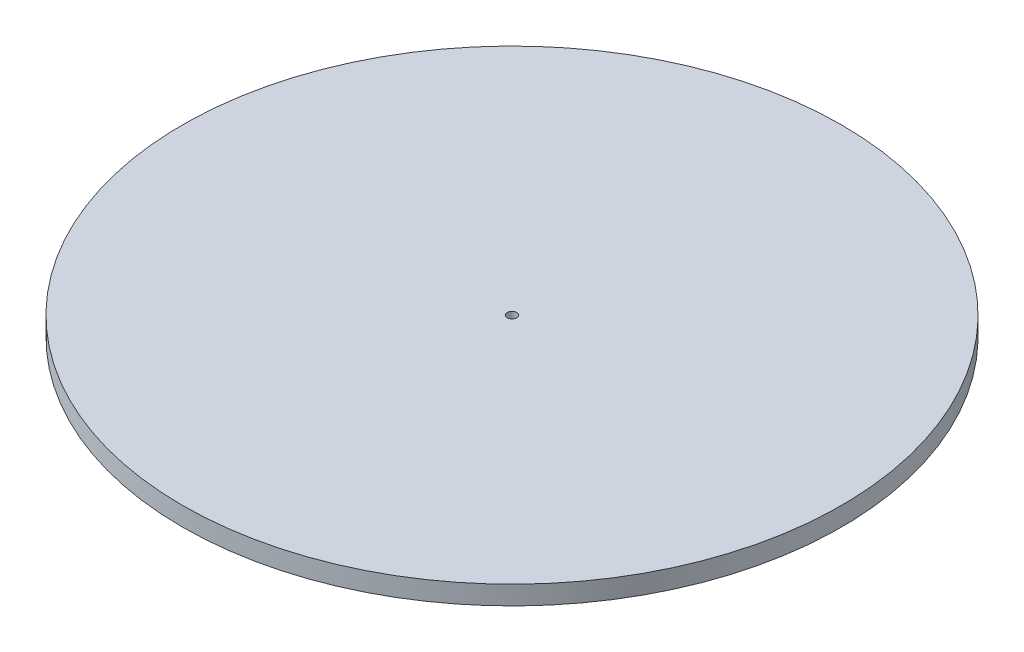
from build123d import *

# Parameters (mm, degrees)
SKETCH_1_R          = 875
EXTRUDE_1_DEPTH     = 50
SKETCH_2_R          = 12.5
CUT_EXTRUDE_1_DEPTH = 1239.44660765


with BuildPart() as part:
    # Эскиз1 → Бобышка-Вытянуть1 (new body)
    with BuildSketch(Plane(origin=(0, 0, 0), x_dir=(1, 0, 0), z_dir=(0, 1, 0))):
        with Locations(Location((0, 0, 0), (0, 0, 270))):
            Circle(SKETCH_1_R)
    extrude(amount=EXTRUDE_1_DEPTH)

    # Эскиз2 → Вырез-Вытянуть1 (cut, through all)
    with BuildSketch(Plane(origin=(0, 50, 0), x_dir=(1, 0, 0), z_dir=(0, 1, 0))):
        with Locations(Location((0, 0, 0), (0, 0, 270))):
            Circle(SKETCH_2_R)
    extrude(amount=-CUT_EXTRUDE_1_DEPTH, mode=Mode.SUBTRACT)


solid = part.part
